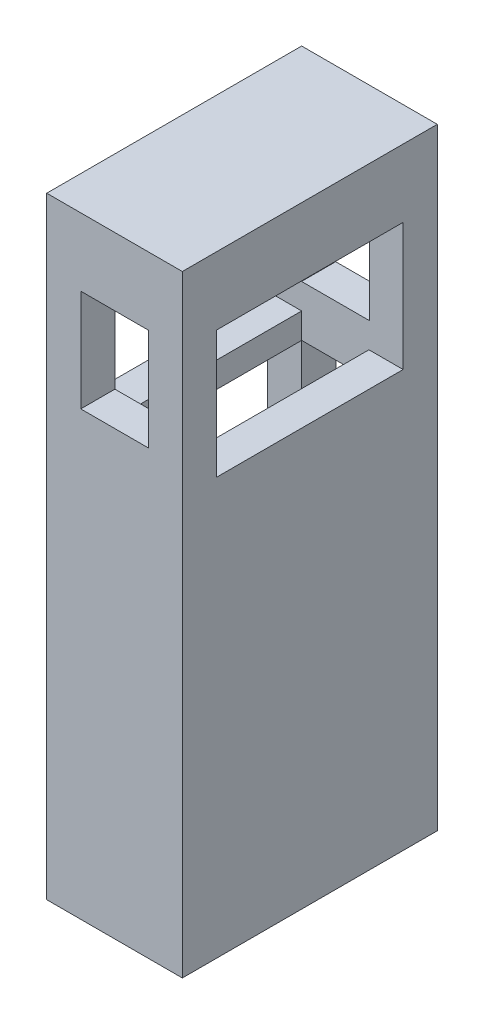
from build123d import *

# Parameters (mm, degrees)
SKETCH2_W               = 2660
SKETCH2_H               = 12000
BOSS_EXTRUDE1_DEPTH     = 5000
SKETCH3_W               = 1330
SKETCH3_H               = 2000
CUT_EXTRUDE1_DEPTH      = 5000
SKETCH4_W               = 3660
SKETCH4_H               = 2500
CUT_EXTRUDE2_DEPTH      = 13270.34813772
SKETCH6_W               = 1320
SKETCH6_H               = 3660
CUT_EXTRUDE3_DEPTH      = 2660
CUT_EXTRUDE6_DEPTH      = 13270.34813772
CUT_EXTRUDE6_DEPTH_BACK = 4269
SKETCH7_W               = 1322.5
SKETCH7_H               = 2660
SKETCH8_W               = 1322.5
SKETCH8_H               = 500
CUT_EXTRUDE7_DEPTH      = 61
SKETCH11_W              = 4269
SKETCH11_H              = 2660
BOSS_EXTRUDE2_DEPTH     = 2.5
SKETCH12_W              = 61
SKETCH12_H              = 500
BOSS_EXTRUDE3_DEPTH     = 2.5
SKETCH17_W              = 3660
SKETCH17_H              = 2660
CUT_EXTRUDE10_DEPTH     = 670
SKETCH21_W              = 2260
SKETCH21_H              = 3660
CUT_EXTRUDE12_DEPTH     = 1000
SKETCH18_W              = 1660
SKETCH18_H              = 4000
CUT_EXTRUDE13_DEPTH     = 4500


with BuildPart() as part:
    # Sketch2 → Boss-Extrude1 (new body)
    with BuildSketch(Plane.XY):
        with Locations((1330, 6000)):
            Rectangle(SKETCH2_W, SKETCH2_H)
    extrude(amount=BOSS_EXTRUDE1_DEPTH)

    # Sketch3 → Cut-Extrude1 (cut)
    with BuildSketch(Plane.XY.offset(5000)):
        with Locations((1332.5, 9670)):
            Rectangle(SKETCH3_W, SKETCH3_H)
    extrude(amount=-CUT_EXTRUDE1_DEPTH, mode=Mode.SUBTRACT)

    # Sketch4 → Cut-Extrude2 (cut, through all)
    with BuildSketch(Plane(origin=(2660, 0, 0), x_dir=(0, 0, -1), z_dir=(1, 0, 0))):
        with Locations((-2500, 9420)):
            Rectangle(SKETCH4_W, SKETCH4_H)
    extrude(amount=-CUT_EXTRUDE2_DEPTH, mode=Mode.SUBTRACT)

    # Sketch6 → Cut-Extrude3 (cut)
    with BuildSketch(Plane(origin=(0, 8170, 0), x_dir=(1, 0, 0), z_dir=(0, 1, 0))):
        with Locations((1330, -2500)):
            Rectangle(SKETCH6_W, SKETCH6_H)
    extrude(amount=-CUT_EXTRUDE3_DEPTH, mode=Mode.SUBTRACT)

    # Sketch7 → Cut-Extrude6 (cut, two sides: drawn at the far end of the back side and taken through both)
    with BuildSketch(Plane(origin=(0, 0, 0), x_dir=(-1, 0, 0), z_dir=(0, 0, -1)).offset(-CUT_EXTRUDE6_DEPTH_BACK)):
        with Locations((-1328.75, 6340)):
            Rectangle(SKETCH7_W, SKETCH7_H)
    extrude(amount=CUT_EXTRUDE6_DEPTH + CUT_EXTRUDE6_DEPTH_BACK, mode=Mode.SUBTRACT)

    # Sketch8 → Cut-Extrude7 (cut)
    with BuildSketch(Plane(origin=(0, 0, 4269), x_dir=(-1, 0, 0), z_dir=(0, 0, -1))):
        with Locations((-1328.75, 5260)):
            Rectangle(SKETCH8_W, SKETCH8_H)
    extrude(amount=-CUT_EXTRUDE7_DEPTH, mode=Mode.SUBTRACT)

    # Sketch11 → Boss-Extrude2 (add)
    with BuildSketch(Plane(origin=(667.5, 0, 0), x_dir=(0, 0, -1), z_dir=(1, 0, 0))):
        with Locations((-2134.5, 6340)):
            Rectangle(SKETCH11_W, SKETCH11_H)
    extrude(amount=BOSS_EXTRUDE2_DEPTH)

    # Sketch12 → Boss-Extrude3 (add)
    with BuildSketch(Plane(origin=(667.5, 0, 0), x_dir=(0, 0, -1), z_dir=(1, 0, 0))):
        with Locations((-4299.5, 5260)):
            Rectangle(SKETCH12_W, SKETCH12_H)
    extrude(amount=BOSS_EXTRUDE3_DEPTH)

    # Sketch17 → Cut-Extrude10 (cut)
    with BuildSketch(Plane.ZY):
        with Locations((2500, 6340)):
            Rectangle(SKETCH17_W, SKETCH17_H)
    extrude(amount=-CUT_EXTRUDE10_DEPTH, mode=Mode.SUBTRACT)

    # Sketch21 → Cut-Extrude12 (cut)
    with BuildSketch(Plane.XZ.offset(-10670)):
        with Locations((1330, 2500)):
            Rectangle(SKETCH21_W, SKETCH21_H)
    extrude(amount=-CUT_EXTRUDE12_DEPTH, mode=Mode.SUBTRACT)

    # Sketch18 → Cut-Extrude13 (cut)
    with BuildSketch(Plane(origin=(0, 0, 0), x_dir=(-1, 0, 0), z_dir=(0, -1, 0))):
        with Locations((-1330, -2500)):
            Rectangle(SKETCH18_W, SKETCH18_H)
    extrude(amount=-CUT_EXTRUDE13_DEPTH, mode=Mode.SUBTRACT)


solid = part.part
